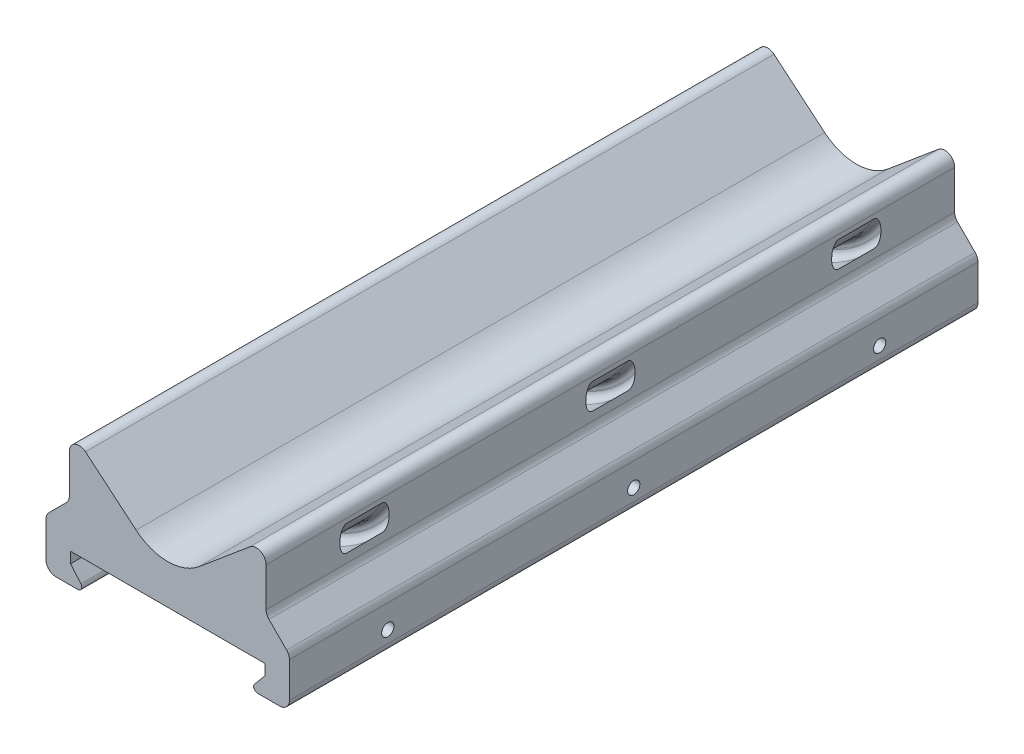
from build123d import *

# Parameters (mm, degrees)
BOSS_EXTRUDE1_DEPTH             = 140
SKETCH2_W                       = 10
SKETCH2_H                       = 3
M3X0_5_TAPPED_HOLE1_D           = 2.5
M3X0_5_TAPPED_HOLE1_CSINK_D     = 3.05
M3X0_5_TAPPED_HOLE1_CSINK_ANGLE = 90
FILLET2_R                       = 1.4


with BuildPart() as part:
    # Sketch1 → Boss-Extrude1 (new body)
    with BuildSketch(Plane.XY):
        with BuildLine():
            Line((6.427876097, 10.393628462), (16.714424781, 19.025067669))
            ThreePointArc((16.714424781, 19.025067669), (18.845236523, 19.305594357), (20, 17.492978783))
            Line((20, 17.492978783), (20, 9.578427125))
            ThreePointArc((20, 9.578427125), (20.152240935, 8.81306026), (20.585786438, 8.164213562))
            Line((20.585786438, 8.164213562), (24.164213562, 4.585786438))
            ThreePointArc((24.164213562, 4.585786438), (24.597759065, 3.93693974), (24.75, 3.171572875))
            Line((24.75, 3.171572875), (24.75, -4))
            ThreePointArc((24.75, -4), (24.164213562, -5.414213562), (22.75, -6))
            Line((22.75, -6), (18.277026938, -6))
            ThreePointArc((18.277026938, -6), (17.551980708, -5.538094609), (17.664191383, -4.685769912))
            Line((17.664191383, -4.685769912), (19.75, -2.2))
            Line((19.75, -2.2), (19.75, 0))
            Line((19.75, 0), (-19.75, 0))
            Line((-19.75, 0), (-19.75, -2.2))
            Line((-19.75, -2.2), (-17.664191383, -4.685769912))
            ThreePointArc((-17.664191383, -4.685769912), (-17.551980708, -5.538094609), (-18.277026938, -6))
            Line((-18.277026938, -6), (-22.75, -6))
            ThreePointArc((-22.75, -6), (-24.164213562, -5.414213562), (-24.75, -4))
            Line((-24.75, -4), (-24.75, 3.171572875))
            ThreePointArc((-24.75, 3.171572875), (-24.597759065, 3.93693974), (-24.164213562, 4.585786438))
            Line((-24.164213562, 4.585786438), (-20.585786438, 8.164213562))
            ThreePointArc((-20.585786438, 8.164213562), (-20.152240935, 8.81306026), (-20, 9.578427125))
            Line((-20, 9.578427125), (-20, 17.492978783))
            ThreePointArc((-20, 17.492978783), (-18.845236523, 19.305594357), (-16.714424781, 19.025067669))
            Line((-16.714424781, 19.025067669), (-6.427876097, 10.393628462))
            ThreePointArc((-6.427876097, 10.393628462), (0, 8.054072893), (6.427876097, 10.393628462))
        make_face()
    extrude(amount=BOSS_EXTRUDE1_DEPTH)

    # Sketch2 → Cut-Revolve1 (revolve, cut)
    with BuildSketch(Plane(origin=(0, 0, 0), x_dir=(0, 0, -1), z_dir=(1, 0, 0))):
        with Locations((-20, 3.5)):
            Rectangle(SKETCH2_W, SKETCH2_H)
        with Locations((-70, 3.5)):
            Rectangle(SKETCH2_W, SKETCH2_H)
        with Locations((-120, 3.5)):
            Rectangle(SKETCH2_W, SKETCH2_H)
    revolve(axis=Axis((0, 28.054072893, 129.353848425), (0, 0, -1)), mode=Mode.SUBTRACT)

    # M3x0.5 Tapped Hole1 (through all)
    with Locations(Plane.ZY.offset(24.75)):
        with Locations((20, -1.555540573), (70, -1.555540573), (120, -1.555540573)):
            CounterSinkHole(M3X0_5_TAPPED_HOLE1_D / 2, M3X0_5_TAPPED_HOLE1_CSINK_D / 2, counter_sink_angle=M3X0_5_TAPPED_HOLE1_CSINK_ANGLE)

    # Fillet2
    fillet2_edges = [part.edges().sort_by_distance(p)[0] for p in [
        (0, 5, 15),
        (0, 2, 15),
        (0, 2, 25),
        (0, 5, 25),
        (0, 5, 65),
        (0, 2, 65),
        (0, 2, 75),
        (0, 5, 75),
        (0, 5, 115),
        (0, 2, 115),
        (0, 2, 125),
        (0, 5, 125),
    ]]
    fillet(fillet2_edges, radius=FILLET2_R)


solid = part.part
